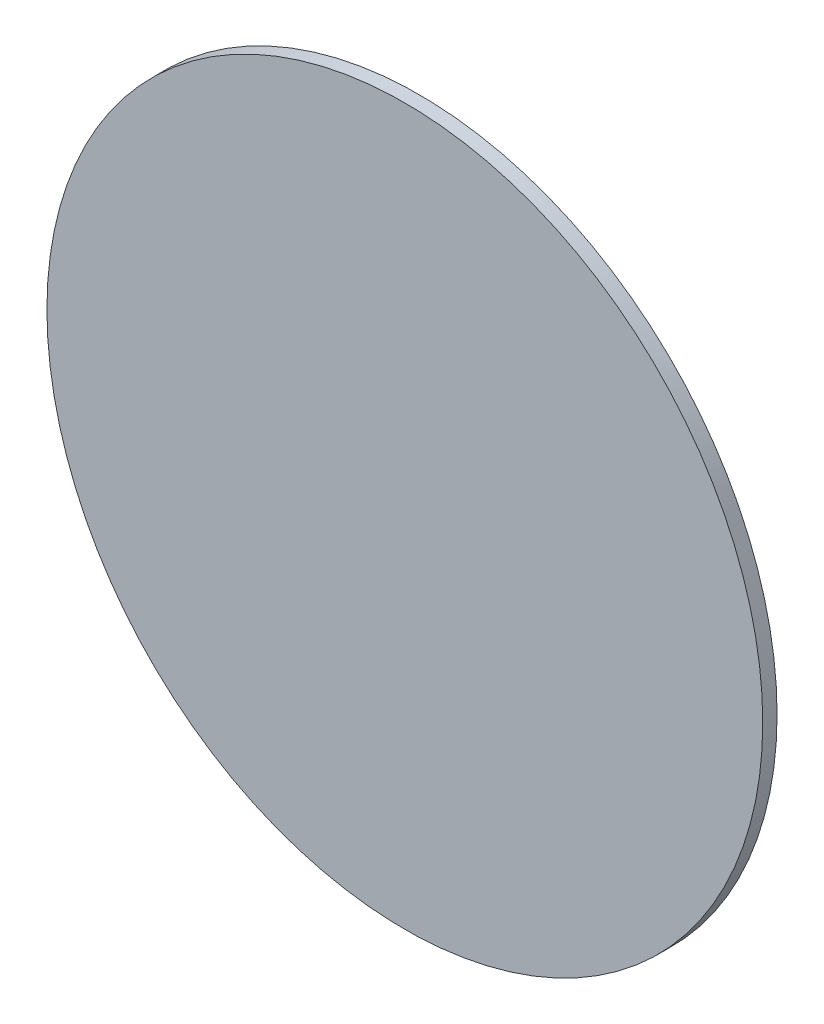
from build123d import *

# Parameters (mm, degrees)
SKETCH1_R           = 63.5
BOSS_EXTRUDE1_DEPTH = 2.54


with BuildPart() as part:
    # Sketch1 → Boss-Extrude1 (new body)
    with BuildSketch(Plane.XY):
        Circle(SKETCH1_R)
    extrude(amount=BOSS_EXTRUDE1_DEPTH)


solid = part.part
